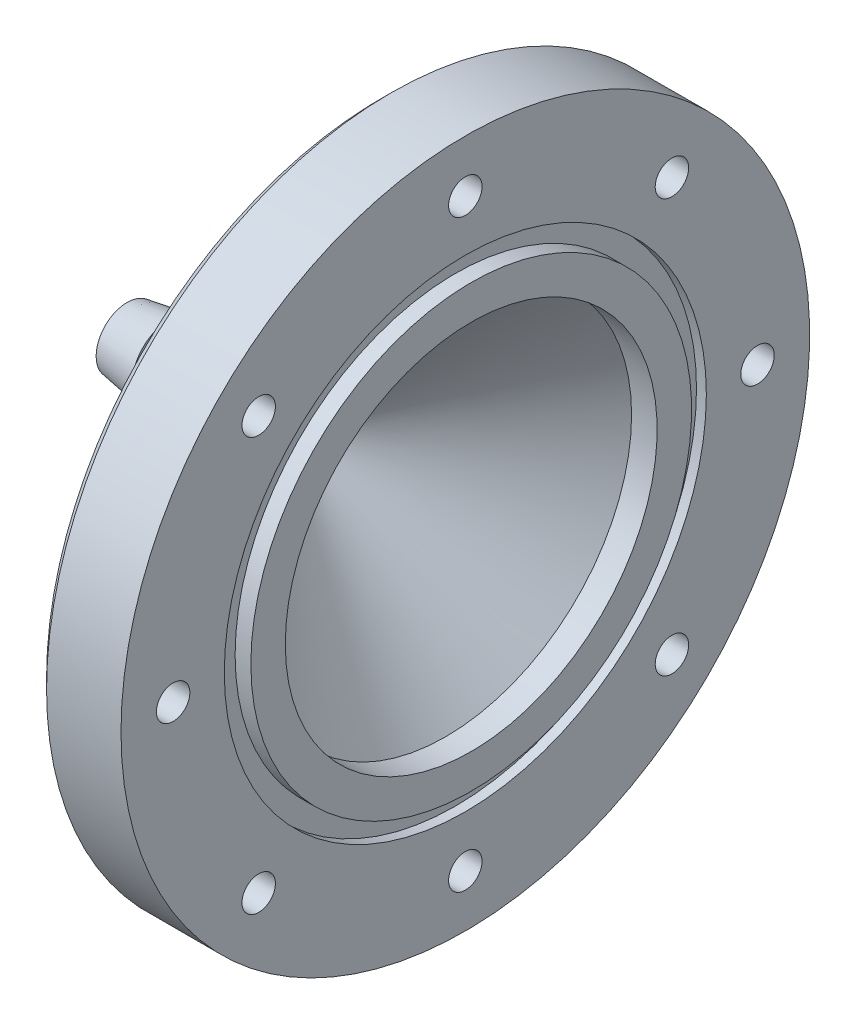
from build123d import *

# Parameters (mm, degrees)
SKETCH1_W                                           = 1.6
SKETCH1_H                                           = 3.5
CBORE_FOR_M3_HEX_SOCKET_HEAD_CAP_SCREW2_D           = 3.4
CBORE_FOR_M3_HEX_SOCKET_HEAD_CAP_SCREW2_DEPTH       = 8.566
CBORE_FOR_M3_HEX_SOCKET_HEAD_CAP_SCREW2_CBORE_D     = 6.5
CBORE_FOR_M3_HEX_SOCKET_HEAD_CAP_SCREW2_CBORE_DEPTH = 3.4
CBORE_FOR_M3_HEX_SOCKET_HEAD_CAP_SCREW2_TIP         = 1.021463052
CHAMFER1_SIZE                                       = 1


with BuildPart() as part:
    # Sketch1 → Revolve17 (revolve)
    with BuildSketch(Plane.XY, mode=Mode.PRIVATE) as revolve17_sk:
        Polygon((-13.572880732, 3.15), (-13.572880732, 3.85), (-17.906214066, 3.15), (-17.906214066, 1.9), (0, 1.9), (14.469928658, 18.9), (15.469928658, 18.9), (15.469928658, 22.4), (15.469928658, 24.5), (16.469928658, 24.5), (16.469928658, 35), (7.903928658, 35), (7.903928658, 18.9), (-4.906214066, 3.85), (-9.239547399, 3.15), (-9.239547399, 3.85), align=None)
        with Locations((16.269928658, 20.65)):
            Rectangle(SKETCH1_W, SKETCH1_H)
    revolve(revolve17_sk.sketch.rotate(Axis((-801.920554309, 0, 0), (1, 0, 0)), 90), axis=Axis((-801.920554309, 0, 0), (1, 0, 0)))

    # CBORE for M3 Hex Socket Head Cap Screw2
    with Locations(Plane.ZY.offset(-7.903928658)):
        with Locations((-21.001071401, -21.154915542), (0, 29.7), (29.7, 0), (-29.7, 0), (0, -29.7), (-21.001071401, 20.847227261), (21.001071401, 20.847227261), (21.001071401, -21.154915542)):
            CounterBoreHole(CBORE_FOR_M3_HEX_SOCKET_HEAD_CAP_SCREW2_D / 2, CBORE_FOR_M3_HEX_SOCKET_HEAD_CAP_SCREW2_CBORE_D / 2, CBORE_FOR_M3_HEX_SOCKET_HEAD_CAP_SCREW2_CBORE_DEPTH, depth=CBORE_FOR_M3_HEX_SOCKET_HEAD_CAP_SCREW2_DEPTH)
            with Locations((0, 0, -(CBORE_FOR_M3_HEX_SOCKET_HEAD_CAP_SCREW2_DEPTH + CBORE_FOR_M3_HEX_SOCKET_HEAD_CAP_SCREW2_TIP / 2))):  # 118° drill point
                Cone(0, CBORE_FOR_M3_HEX_SOCKET_HEAD_CAP_SCREW2_D / 2, CBORE_FOR_M3_HEX_SOCKET_HEAD_CAP_SCREW2_TIP, mode=Mode.SUBTRACT)

    # Chamfer1
    chamfer1_edges = [part.edges().sort_by_distance(p)[0] for p in [
        (7.903928658, 0, -35),
    ]]
    chamfer(chamfer1_edges, length=CHAMFER1_SIZE)


solid = part.part
